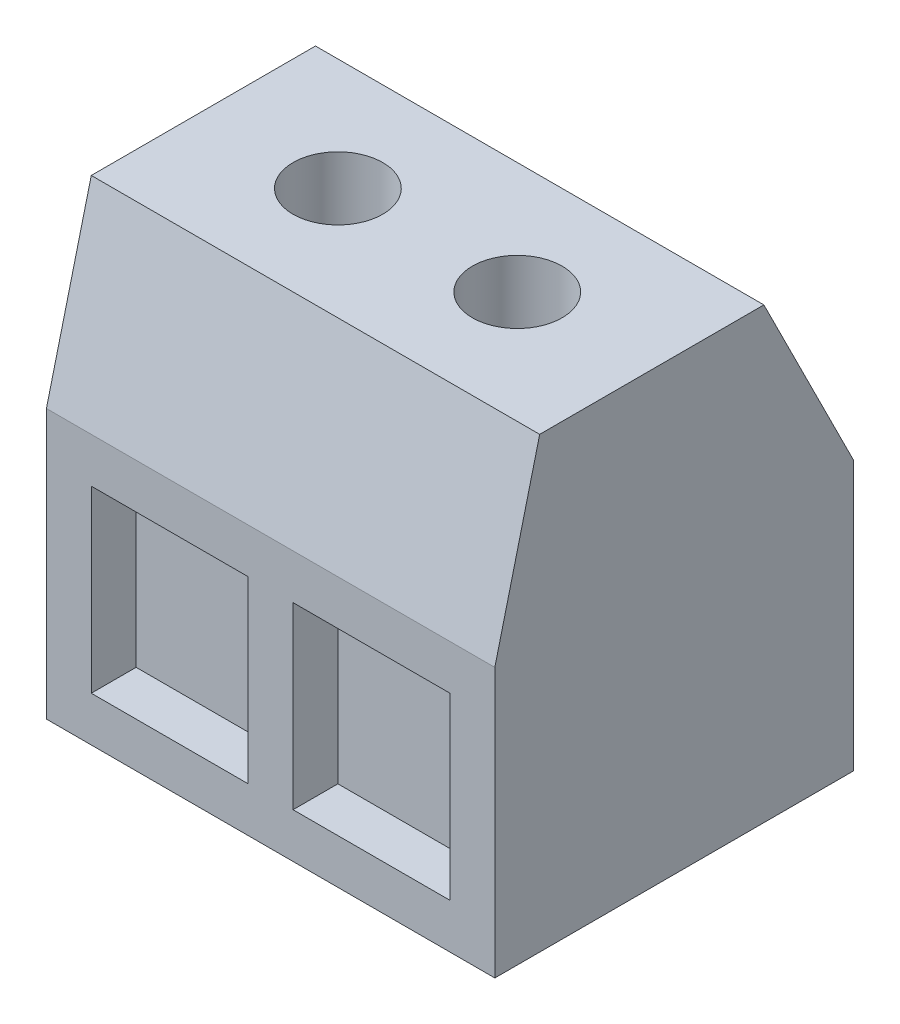
from build123d import *

# Parameters (mm, degrees)
SKETCH1_W           = 10
SKETCH1_H           = 8
BOSS_EXTRUDE1_DEPTH = 10
CUT_EXTRUDE1_DEPTH  = 10
SKETCH4_R           = 1
CUT_EXTRUDE2_DEPTH  = 2
SKETCH5_W           = 3.5
SKETCH5_H           = 4
CUT_EXTRUDE3_DEPTH  = 1


with BuildPart() as part:
    # Sketch1 → Boss-Extrude1 (new body)
    with BuildSketch(Plane(origin=(0, 0, 0), x_dir=(1, 0, 0), z_dir=(0, 1, 0))):
        with Locations((5, 4)):
            Rectangle(SKETCH1_W, SKETCH1_H)
    extrude(amount=BOSS_EXTRUDE1_DEPTH)

    # Sketch3 → Cut-Extrude1 (cut)
    with BuildSketch(Plane(origin=(10, 0, 0), x_dir=(0, 0, -1), z_dir=(1, 0, 0))):
        Polygon((0, 6), (1, 10), (6, 10), (8, 6), (9, 6), (9, 11), (-1, 11), (-1, 6), align=None)
    extrude(amount=-CUT_EXTRUDE1_DEPTH, mode=Mode.SUBTRACT)

    # Sketch4 → Cut-Extrude2 (cut)
    with BuildSketch(Plane(origin=(0, 10, 0), x_dir=(1, 0, 0), z_dir=(0, 1, 0))):
        with Locations(Location((3, 3.5, 0), (0, 0, 270))):
            Circle(SKETCH4_R)
        with Locations(Location((7, 3.5, 0), (0, 0, 270))):
            Circle(SKETCH4_R)
    extrude(amount=-CUT_EXTRUDE2_DEPTH, mode=Mode.SUBTRACT)

    # Sketch5 → Cut-Extrude3 (cut)
    with BuildSketch(Plane.XY):
        with Locations((2.75, 3)):
            Rectangle(SKETCH5_W, SKETCH5_H)
        with Locations((7.25, 3)):
            Rectangle(SKETCH5_W, SKETCH5_H)
    extrude(amount=-CUT_EXTRUDE3_DEPTH, mode=Mode.SUBTRACT)


solid = part.part
